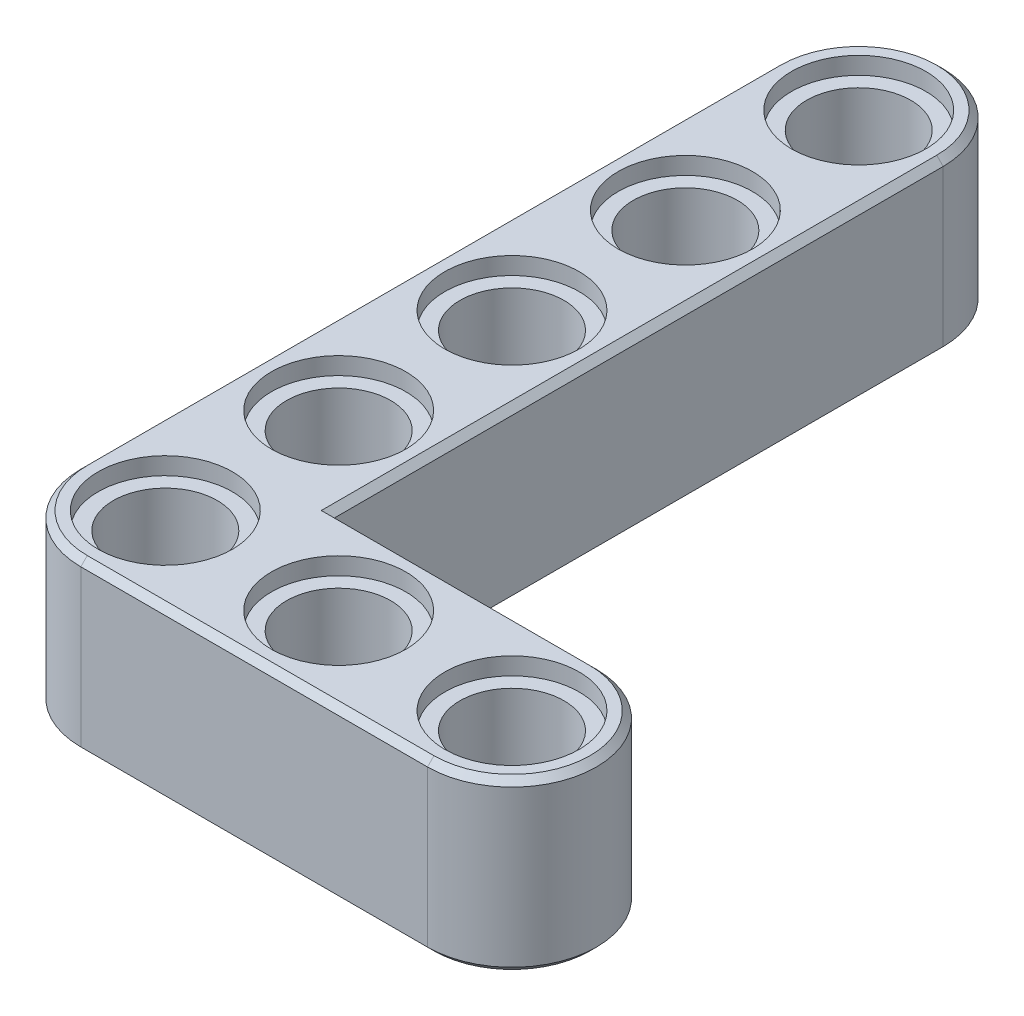
from build123d import *

# Parameters (mm, degrees)
BOSS_EXTRUDE1_DEPTH       = 3.9
FILLET1_R                 = 3.9
SKETCH2_R                 = 2.4
CUT_EXTRUDE2_DEPTH        = 42.781096204
SKETCH4_R                 = 3.1
CUT_EXTRUDE3_DEPTH        = 0.8
LPATTERN1_COUNT           = 5
LPATTERN1_PITCH           = 8
LPATTERN1_COPY_1_SKETCH_R = 3.1
LPATTERN1_COPY_1_DEPTH    = 0.8
LPATTERN1_COPY_2_SKETCH_R = 3.1
LPATTERN1_COPY_2_DEPTH    = 0.8
LPATTERN1_COPY_3_SKETCH_R = 3.1
LPATTERN1_COPY_3_DEPTH    = 0.8
LPATTERN1_COPY_4_SKETCH_R = 3.1
LPATTERN1_COPY_4_DEPTH    = 0.8
LPATTERN2_COUNT           = 3
LPATTERN2_PITCH           = 8
LPATTERN2_COPY_1_SKETCH_R = 3.1
LPATTERN2_COPY_1_DEPTH    = 0.8
LPATTERN2_COPY_2_SKETCH_R = 3.1
LPATTERN2_COPY_2_DEPTH    = 0.8
CHAMFER1_SIZE             = 0.3


with BuildPart() as part:
    # Sketch1 → Boss-Extrude1 (new, symmetric)
    with BuildSketch(Plane(origin=(0, 0, 0), x_dir=(1, 0, 0), z_dir=(0, 1, 0))):
        with BuildLine():
            Line((3.9, 3.9), (16, 3.9))
            ThreePointArc((16, 3.9), (19.9, 0), (16, -3.9))
            Line((16, -3.9), (-3.9, -3.9))
            Line((-3.9, -3.9), (-3.9, 32))
            ThreePointArc((-3.9, 32), (0, 35.9), (3.9, 32))
            Line((3.9, 32), (3.9, 3.9))
        make_face()
    extrude(amount=BOSS_EXTRUDE1_DEPTH, both=True)

    # Fillet1
    fillet1_edges = [part.edges().sort_by_distance(p)[0] for p in [
        (-3.9, 0, 3.9),
    ]]
    fillet(fillet1_edges, radius=FILLET1_R)

    # Sketch2 → Cut-Extrude2 (cut, through all)
    with BuildSketch(Plane(origin=(0, 3.9, 0), x_dir=(1, 0, 0), z_dir=(0, 1, 0))):
        with Locations(Location((0, 0, 0), (0, 0, 270))):
            Circle(SKETCH2_R)
    cut_extrude2 = extrude(amount=-CUT_EXTRUDE2_DEPTH, mode=Mode.SUBTRACT)

    # Sketch4 → Cut-Extrude3 (cut)
    with BuildSketch(Plane(origin=(0, 3.9, 0), x_dir=(1, 0, 0), z_dir=(0, 1, 0))):
        with Locations(Location((0, 0, 0), (0, 0, 270))):
            Circle(SKETCH4_R)
    cut_extrude3 = extrude(amount=-CUT_EXTRUDE3_DEPTH, mode=Mode.SUBTRACT)

    # Mirror1: Cut-Extrude3 across plane
    add(cut_extrude3.mirror(Plane.ZX), mode=Mode.SUBTRACT)

    # LPattern1: Cut-Extrude2, Cut-Extrude3 ×5
    with Locations(*[(0, 0, -i * LPATTERN1_PITCH) for i in range(1, LPATTERN1_COUNT)]):
        add(cut_extrude2, mode=Mode.SUBTRACT)
        add(cut_extrude3, mode=Mode.SUBTRACT)

    # LPattern1 copy 1 sketch → LPattern1 copy 1 (cut)
    with BuildSketch(Plane(origin=(0, -3.9, -8), x_dir=(1, 0, 0), z_dir=(0, -1, 0))):
        Circle(LPATTERN1_COPY_1_SKETCH_R)
    extrude(amount=-LPATTERN1_COPY_1_DEPTH, mode=Mode.SUBTRACT)

    # LPattern1 copy 2 sketch → LPattern1 copy 2 (cut)
    with BuildSketch(Plane(origin=(0, -3.9, -16), x_dir=(1, 0, 0), z_dir=(0, -1, 0))):
        Circle(LPATTERN1_COPY_2_SKETCH_R)
    extrude(amount=-LPATTERN1_COPY_2_DEPTH, mode=Mode.SUBTRACT)

    # LPattern1 copy 3 sketch → LPattern1 copy 3 (cut)
    with BuildSketch(Plane(origin=(0, -3.9, -24), x_dir=(1, 0, 0), z_dir=(0, -1, 0))):
        Circle(LPATTERN1_COPY_3_SKETCH_R)
    extrude(amount=-LPATTERN1_COPY_3_DEPTH, mode=Mode.SUBTRACT)

    # LPattern1 copy 4 sketch → LPattern1 copy 4 (cut)
    with BuildSketch(Plane(origin=(0, -3.9, -32), x_dir=(1, 0, 0), z_dir=(0, -1, 0))):
        Circle(LPATTERN1_COPY_4_SKETCH_R)
    extrude(amount=-LPATTERN1_COPY_4_DEPTH, mode=Mode.SUBTRACT)

    # LPattern2: Cut-Extrude2, Cut-Extrude3 ×3
    with Locations(*[(i * LPATTERN2_PITCH, 0, 0) for i in range(1, LPATTERN2_COUNT)]):
        add(cut_extrude2, mode=Mode.SUBTRACT)
        add(cut_extrude3, mode=Mode.SUBTRACT)

    # LPattern2 copy 1 sketch → LPattern2 copy 1 (cut)
    with BuildSketch(Plane(origin=(8, -3.9, 0), x_dir=(1, 0, 0), z_dir=(0, -1, 0))):
        Circle(LPATTERN2_COPY_1_SKETCH_R)
    extrude(amount=-LPATTERN2_COPY_1_DEPTH, mode=Mode.SUBTRACT)

    # LPattern2 copy 2 sketch → LPattern2 copy 2 (cut)
    with BuildSketch(Plane(origin=(16, -3.9, 0), x_dir=(1, 0, 0), z_dir=(0, -1, 0))):
        Circle(LPATTERN2_COPY_2_SKETCH_R)
    extrude(amount=-LPATTERN2_COPY_2_DEPTH, mode=Mode.SUBTRACT)

    # Chamfer1
    chamfer1_edges = [part.edges().sort_by_distance(p)[0] for p in [
        (-3.9, 3.9, -16),
        (8, -3.9, 3.9),
        (8, 3.9, 3.9),
        (19.9, 3.9, 0),
        (-2.757716447, -3.9, 2.757716447),
        (-2.757716447, 3.9, 2.757716447),
        (9.95, 3.9, -3.9),
        (3.9, 3.9, -17.95),
        (9.95, -3.9, -3.9),
        (19.9, -3.9, 0),
        (-3.9, -3.9, -16),
        (0, -3.9, -35.9),
        (3.9, -3.9, -17.95),
        (0, 3.9, -35.9),
    ]]
    chamfer(chamfer1_edges, length=CHAMFER1_SIZE)


solid = part.part
